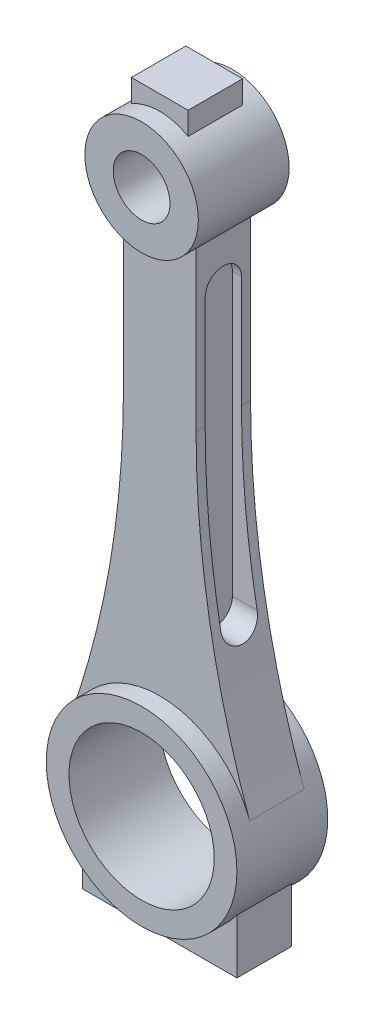
from build123d import *

# Parameters (mm, degrees)
SKETCH2_R             = 12.5
SKETCH2_R_2           = 6.25
BOSS_EXTRUDE1_DEPTH   = 10
SKETCH2_R_3           = 21
SKETCH2_R_4           = 16
BOSS_EXTRUDE1_2_DEPTH = 10
BOSS_EXTRUDE2_DEPTH   = 6
CUT_EXTRUDE1_START    = 6
CUT_EXTRUDE1_DEPTH    = 132.802456026
CUT_EXTRUDE2_START    = -6
CUT_EXTRUDE2_DEPTH    = 132.802456026


with BuildPart() as part:
    # Sketch2 → Boss-Extrude1 (new, symmetric)
    with BuildSketch(Plane.XY):
        with Locations((0, 120)):
            Circle(SKETCH2_R)
        with Locations((0, 120)):
            Circle(SKETCH2_R_2, mode=Mode.SUBTRACT)
    extrude(amount=BOSS_EXTRUDE1_DEPTH, both=True)



with BuildPart() as body_2:
    # Sketch2 → Boss-Extrude1 2 (new, symmetric)
    with BuildSketch(Plane.XY):
        Circle(SKETCH2_R_3)
        Circle(SKETCH2_R_4, mode=Mode.SUBTRACT)
    extrude(amount=BOSS_EXTRUDE1_2_DEPTH, both=True)


with BuildPart() as part_1:
    add(part.part)

    add(body_2.part)  # Boss-Extrude2 merges body 2
    # Sketch2<4> → Boss-Extrude2 (add, symmetric)
    with BuildSketch(Plane.XY):
        with BuildLine():
            ThreePointArc((17, -12.328828006), (0, -21), (-17, -12.328828006))
            Line((-17, -12.328828006), (-17, -24.328828006))
            Line((-17, -24.328828006), (17, -24.328828006))
            Line((17, -24.328828006), (17, -12.328828006))
        make_face()
        with BuildLine():
            ThreePointArc((-8, 75.395313644), (-10.96842855, 40.709642053), (-19.787382488, 7.032744434))
            ThreePointArc((-19.787382488, 7.032744434), (0, 21), (19.787382488, 7.032744434))
            ThreePointArc((19.787382488, 7.032744434), (10.96842855, 40.709642053), (8, 75.395313644))
            Line((8, 75.395313644), (8, 110.395313644))
            ThreePointArc((8, 110.395313644), (0, 107.5), (-8, 110.395313644))
            Line((-8, 110.395313644), (-8, 75.395313644))
        make_face()
        with BuildLine():
            Line((-6.25, 135.825317547), (-6.25, 130.825317547))
            ThreePointArc((-6.25, 130.825317547), (0, 132.5), (6.25, 130.825317547))
            Line((6.25, 130.825317547), (6.25, 135.825317547))
            Line((6.25, 135.825317547), (-6.25, 135.825317547))
        make_face()
    extrude(amount=BOSS_EXTRUDE2_DEPTH, both=True)

    # Sketch3 → Cut-Extrude1 (cut, through all)
    with BuildSketch(Plane(origin=(0, 0, 0), x_dir=(0, 0, -1), z_dir=(1, 0, 0)).offset(CUT_EXTRUDE1_START)):
        with BuildLine():
            Line((4, 100), (4, 38))
            ThreePointArc((4, 38), (0, 34), (-4, 38))
            Line((-4, 38), (-4, 100))
            ThreePointArc((-4, 100), (0, 104), (4, 100))
        make_face()
    extrude(amount=CUT_EXTRUDE1_DEPTH, mode=Mode.SUBTRACT)

    # Sketch3<2> → Cut-Extrude2 (cut, through all)
    with BuildSketch(Plane(origin=(0, 0, 0), x_dir=(0, 0, -1), z_dir=(1, 0, 0)).offset(CUT_EXTRUDE2_START)):
        with BuildLine():
            Line((4, 100), (4, 38))
            ThreePointArc((4, 38), (0, 34), (-4, 38))
            Line((-4, 38), (-4, 100))
            ThreePointArc((-4, 100), (0, 104), (4, 100))
        make_face()
    extrude(amount=-CUT_EXTRUDE2_DEPTH, mode=Mode.SUBTRACT)


solid = part_1.part
